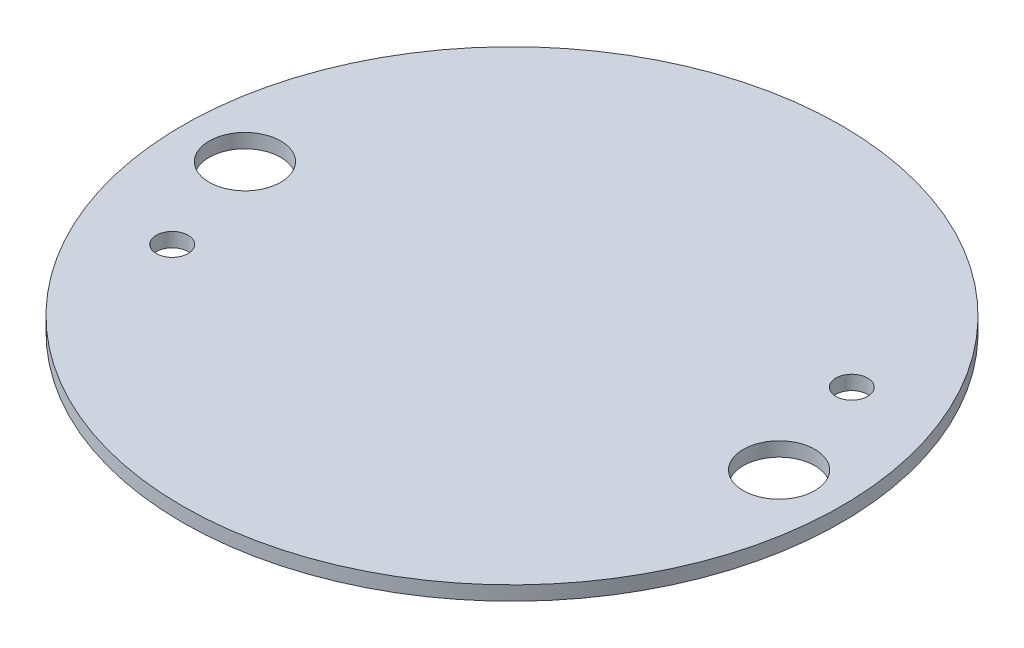
from build123d import *

# Parameters (mm, degrees)
SKETCH1_R           = 73.66
BOSS_EXTRUDE1_DEPTH = 3.175
SKETCH2_R           = 8.001
SKETCH2_R_2         = 3.556
CUT_EXTRUDE1_DEPTH  = 3.175


with BuildPart() as part:
    # Sketch1 → Boss-Extrude1 (new body)
    with BuildSketch(Plane(origin=(0, 0, 0), x_dir=(1, 0, 0), z_dir=(0, 1, 0))):
        with Locations(Location((0, 0, 0), (0, 0, 270))):
            Circle(SKETCH1_R)
    extrude(amount=BOSS_EXTRUDE1_DEPTH)

    # Sketch2 → Cut-Extrude1 (cut)
    with BuildSketch(Plane(origin=(0, 3.175, 0), x_dir=(1, 0, 0), z_dir=(0, 1, 0))):
        with Locations(Location((-59.69, 0, 0), (0, 0, 270))):
            Circle(SKETCH2_R)
        with Locations(Location((59.69, 0, 0), (0, 0, 270))):
            Circle(SKETCH2_R)
        with Locations(Location((-51.795490029, -24.152633658, 0), (0, 0, 270))):
            Circle(SKETCH2_R_2)
        with Locations(Location((51.795490029, 24.152633658, 0), (0, 0, 270))):
            Circle(SKETCH2_R_2)
    extrude(amount=-CUT_EXTRUDE1_DEPTH, mode=Mode.SUBTRACT)


solid = part.part
